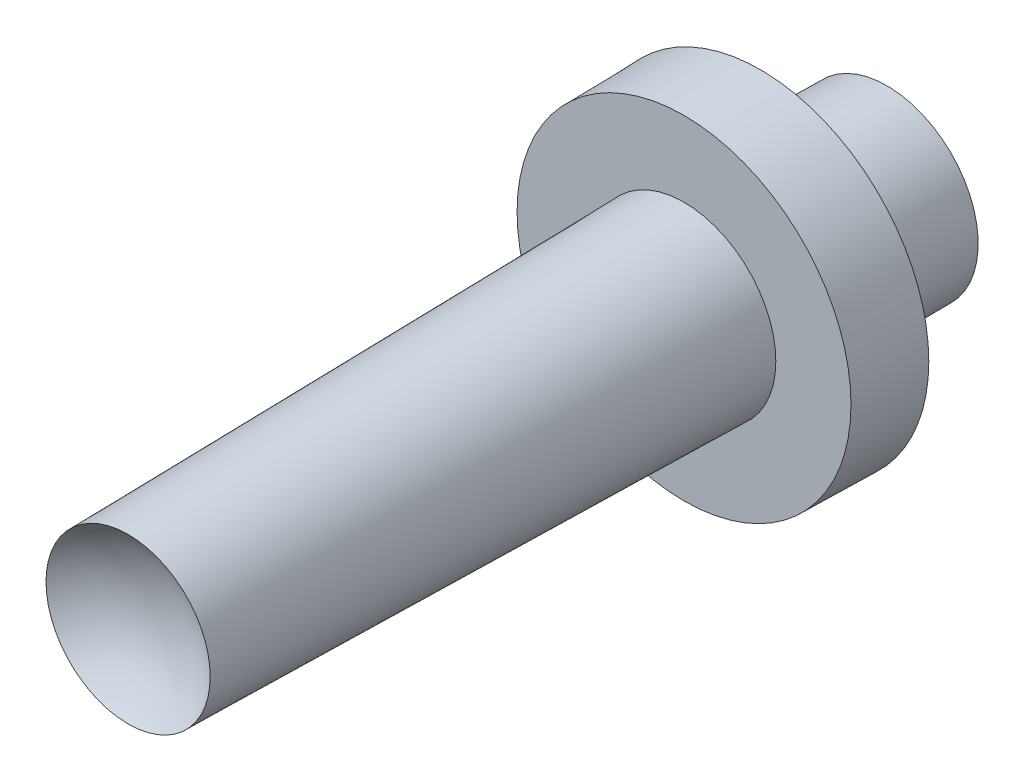
from build123d import *

# Parameters (mm, degrees)
SKETCH1_R           = 2.794
BOSS_EXTRUDE1_DEPTH = 1.27
BOSS_EXTRUDE1_TAPER = 1
SKETCH2_R           = 1.524
BOSS_EXTRUDE2_DEPTH = 9.23000005
BOSS_EXTRUDE2_TAPER = 1
SKETCH3_R           = 1.549999948
BOSS_EXTRUDE3_DEPTH = 2.1
BOSS_EXTRUDE3_TAPER = 1


with BuildPart() as part:
    # Sketch1 → Boss-Extrude1 (new body)
    with BuildSketch(Plane.XY):
        Circle(SKETCH1_R)
    extrude(amount=BOSS_EXTRUDE1_DEPTH, taper=BOSS_EXTRUDE1_TAPER)

    # Sketch2 → Boss-Extrude2 (add)
    with BuildSketch(Plane.XY.offset(1.27)):
        Circle(SKETCH2_R)
    extrude(amount=BOSS_EXTRUDE2_DEPTH, taper=BOSS_EXTRUDE2_TAPER)

    # Sketch3 → Boss-Extrude3 (add)
    with BuildSketch(Plane(origin=(0, 0, 0), x_dir=(-1, 0, 0), z_dir=(0, 0, -1))):
        Circle(SKETCH3_R)
    extrude(amount=BOSS_EXTRUDE3_DEPTH, taper=BOSS_EXTRUDE3_TAPER)

    # Sketch5 → Cut-Revolve4 (revolve, cut)
    with BuildSketch(Plane(origin=(0, 0, 0), x_dir=(1, 0, 0), z_dir=(0, 1, 0))):
        with BuildLine():
            Line((0, -10.50000005), (0, -9.94120005))
            ThreePointArc((0, -9.94120005), (0.736499476, -10.086324189), (1.36288975, -10.50000005))
            Line((1.36288975, -10.50000005), (1.36288975, -10.823922581))
            Line((1.36288975, -10.823922581), (0, -10.823922581))
            Line((0, -10.823922581), (0, -10.50000005))
        make_face()
    revolve(axis=Axis((0, 0, 1.27), (0, 0, 1)), mode=Mode.SUBTRACT)


solid = part.part
